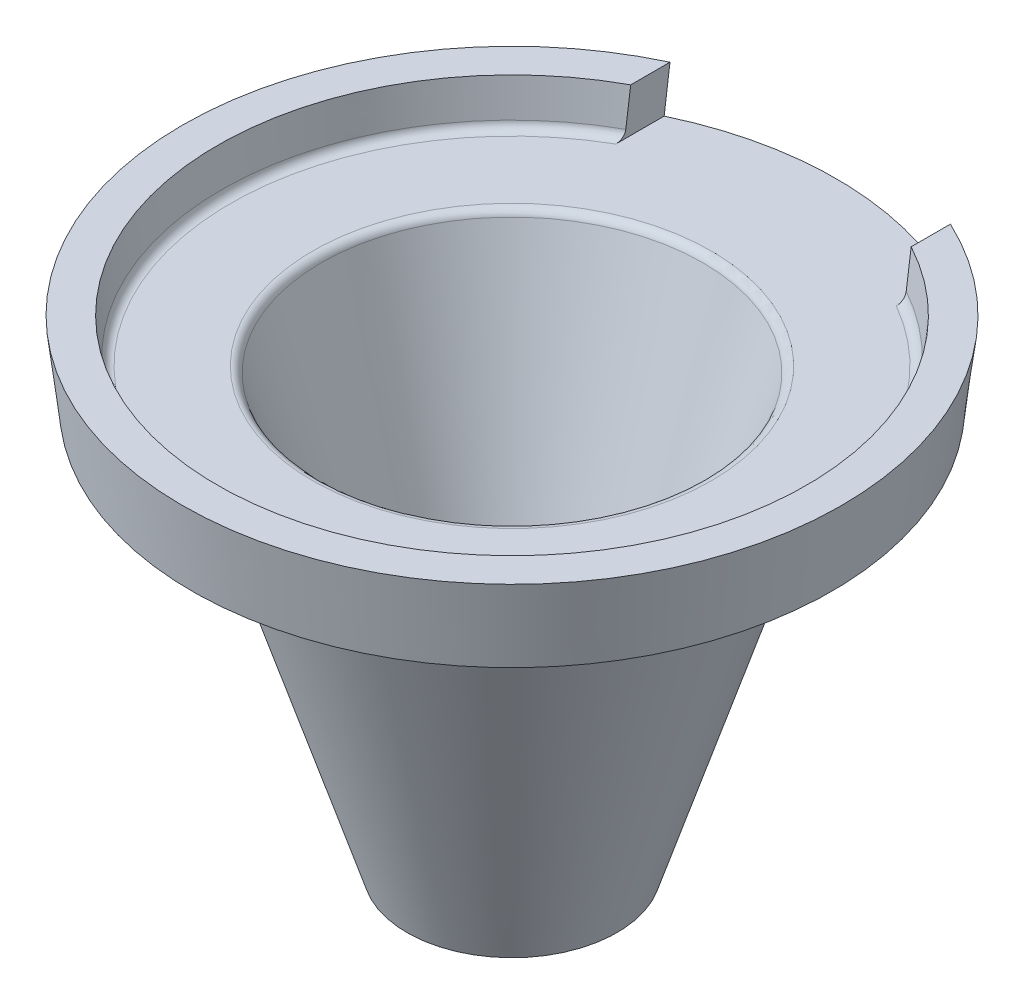
from build123d import *

# Parameters (mm, degrees)
SKETCH2_W          = 32
SKETCH2_H          = 5
CUT_EXTRUDE2_DEPTH = 77.50062169
FILLET1_R          = 1
FILLET2_R          = 1


with BuildPart() as part:
    # Sketch1 → Revolve1 (revolve)
    with BuildSketch(Plane.XY):
        Polygon((-12, 0), (-6, 0), (-22, 50), (-22, 46), (-26.72, 46), align=None)
        Polygon((-36.520930233, 46), (-26.72, 46), (-28, 50), (-33, 50), (-37, 50), align=None)
        Polygon((-22, 46), (-22, 50), (-28, 50), (-26.72, 46), align=None)
        Polygon((-37, 50), (-33, 50), (-33.598837209, 55), (-37.598837209, 55), align=None)
    revolve(axis=Axis((0, 50, 0), (0, -1, 0)))

    # Sketch2 → Cut-Extrude2 (cut, through all)
    with BuildSketch(Plane.XY):
        with Locations((0, 52.5)):
            Rectangle(SKETCH2_W, SKETCH2_H)
    extrude(amount=-CUT_EXTRUDE2_DEPTH, mode=Mode.SUBTRACT)

    # Fillet1
    fillet1_edges = [part.edges().sort_by_distance(p)[0] for p in [
        (0, 50, 33),
    ]]
    fillet(fillet1_edges, radius=FILLET1_R)

    # Fillet2
    fillet2_edges = [part.edges().sort_by_distance(p)[0] for p in [
        (22, 50, 0),
    ]]
    fillet(fillet2_edges, radius=FILLET2_R)


solid = part.part
